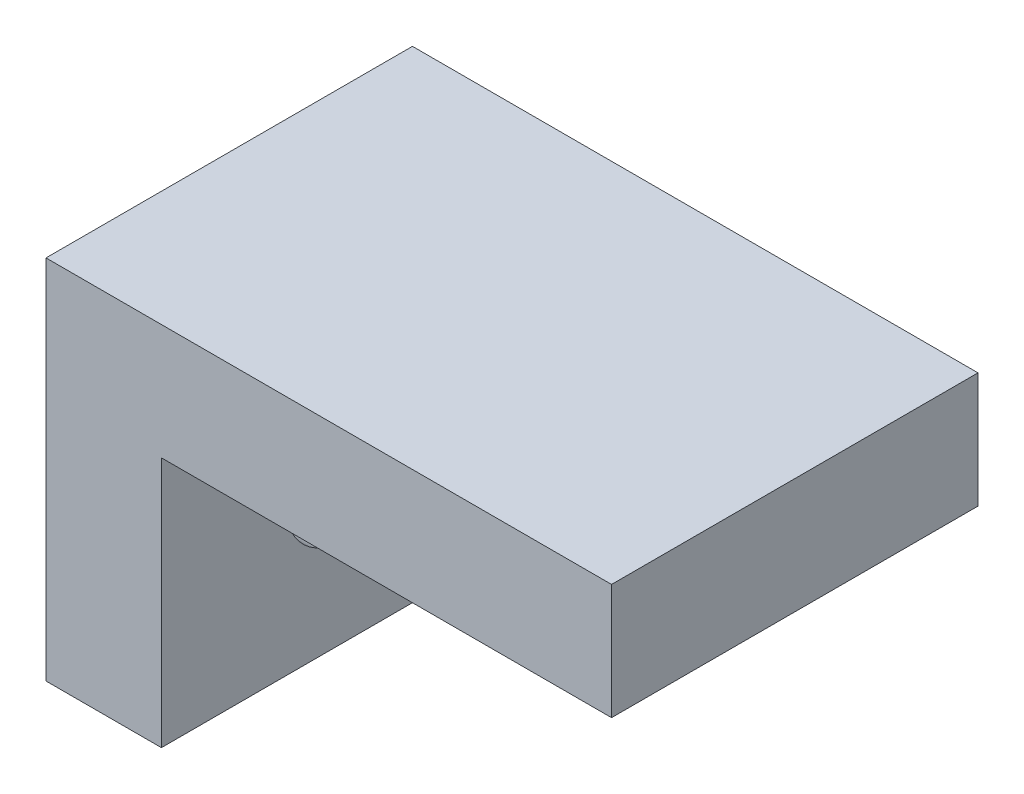
from build123d import *

# Parameters (mm, degrees)
BOSS_EXTRUDE1_DEPTH    = 7.9375
F_10_CLEARANCE_HOLE1_D = 5.1054


with BuildPart() as part:
    # Sketch2 → Boss-Extrude1 (new, symmetric)
    with BuildSketch(Plane.XY):
        Polygon((-2.5, 7.9375), (2.5, 7.9375), (22, 7.9375), (22, 2.9375), (2.5, 2.9375), (2.5, -7.9375), (-2.5, -7.9375), align=None)
    extrude(amount=BOSS_EXTRUDE1_DEPTH, both=True)

    # #10 Clearance Hole1 (through all)
    with Locations(Plane(origin=(2.5, 0, 0), x_dir=(0, 0, -1), z_dir=(1, 0, 0))):
        with Locations((0, -1.5625)):
            Hole(F_10_CLEARANCE_HOLE1_D / 2)


solid = part.part
